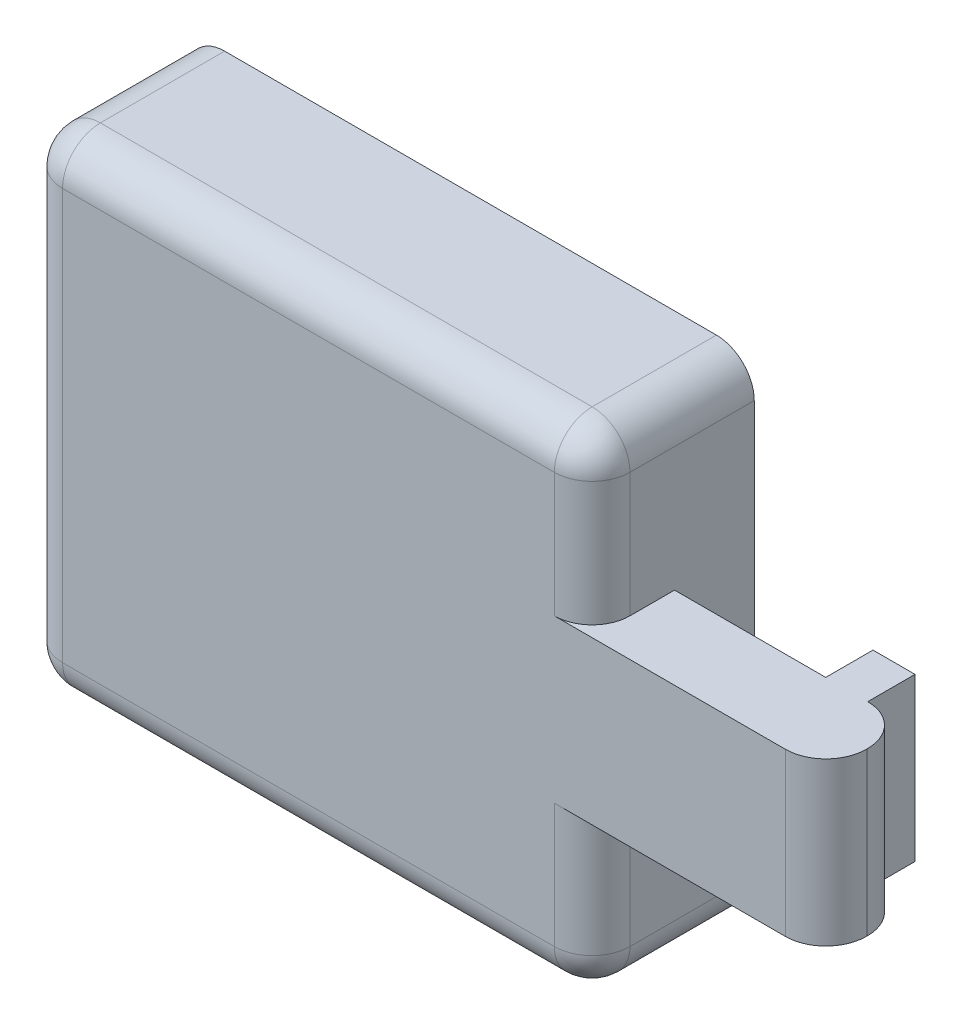
from build123d import *

# Parameters (mm, degrees)
SKETCH1_W           = 4.2
SKETCH1_H           = 3.6
BOSS_EXTRUDE1_DEPTH = 1.2
SKETCH2_W           = 0.61
SKETCH2_H           = 1.2
BOSS_EXTRUDE2_DEPTH = 1.73
FILLET6_R           = 0.28
FILLET8_R           = 0.3
SKETCH8_W           = 0.311061498
SKETCH8_H           = 1.2
BOSS_EXTRUDE3_DEPTH = 0.35


with BuildPart() as part:
    # Sketch1 → Boss-Extrude1 (new body)
    with BuildSketch(Plane.XY):
        with Locations((-50.865642715, 22.034539222)):
            Rectangle(SKETCH1_W, SKETCH1_H)
    extrude(amount=BOSS_EXTRUDE1_DEPTH)

    # Sketch2 → Boss-Extrude2 (add)
    with BuildSketch(Plane(origin=(-48.765642715, 0, 0), x_dir=(0, 0, -1), z_dir=(1, 0, 0))):
        with Locations((-0.895, 22.034539222)):
            Rectangle(SKETCH2_W, SKETCH2_H)
    extrude(amount=BOSS_EXTRUDE2_DEPTH)

    # Fillet6
    fillet6_edges = [part.edges().sort_by_distance(p)[0] for p in [
        (-48.765642715, 20.834539222, 1.2),
        (-48.765642715, 23.234539222, 1.2),
        (-50.865642715, 23.834539222, 1.2),
        (-52.965642715, 22.034539222, 1.2),
        (-52.965642715, 23.834539222, 0.6),
        (-48.765642715, 23.834539222, 0.6),
        (-48.765642715, 20.234539222, 0.6),
        (-52.965642715, 20.234539222, 0.6),
        (-50.865642715, 20.234539222, 1.2),
    ]]
    fillet(fillet6_edges, radius=FILLET6_R)

    # Fillet8
    fillet8_edges = [part.edges().sort_by_distance(p)[0] for p in [
        (-47.035642715, 22.034539222, 0.59),
        (-47.035642715, 22.034539222, 1.2),
    ]]
    fillet(fillet8_edges, radius=FILLET8_R)

    # Sketch8 → Boss-Extrude3 (add)
    with BuildSketch(Plane(origin=(0, 0, 0.59), x_dir=(-1, 0, 0), z_dir=(0, 0, -1))):
        with Locations((47.491173464, 22.034539222)):
            Rectangle(SKETCH8_W, SKETCH8_H)
    extrude(amount=BOSS_EXTRUDE3_DEPTH)


solid = part.part
